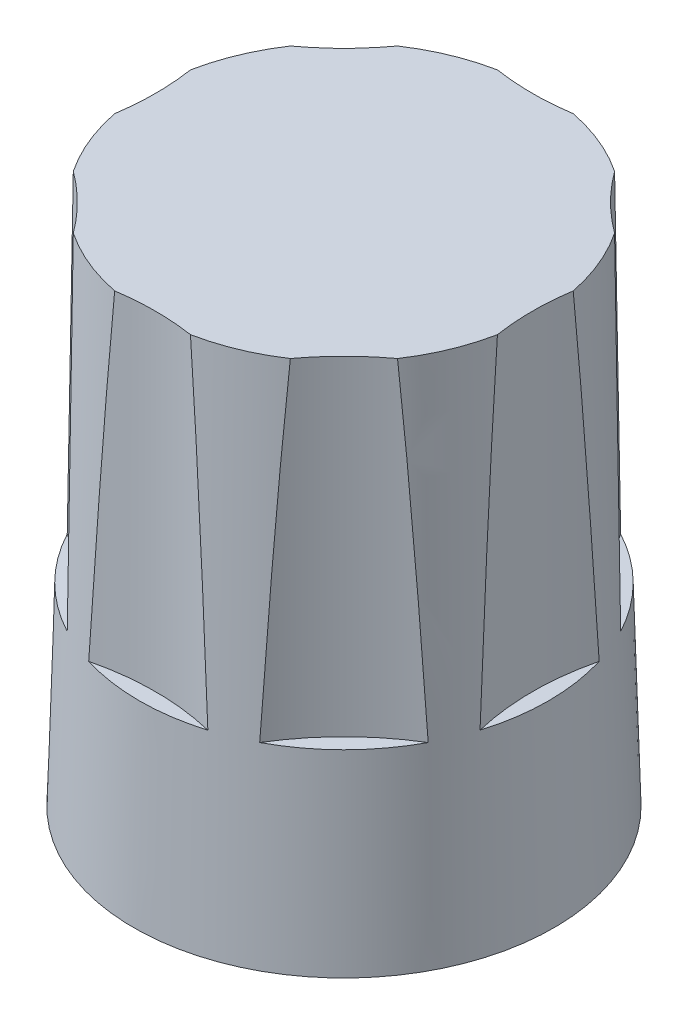
from build123d import *

# Parameters (mm, degrees)
SKETCH2_R           = 7.624300038
CUT_EXTRUDE1_DEPTH  = 10
CIRPATTERN1_COUNT   = 8
SKETCH3_W           = 1.605
SKETCH3_H           = 0.82
SKETCH3_W_2         = 0.82
SKETCH3_H_2         = 1.605
BOSS_EXTRUDE1_DEPTH = 14.88


with BuildPart() as part:
    # Sketch1 → Revolve1 (revolve)
    with BuildSketch(Plane.XY, mode=Mode.PRIVATE) as revolve1_sk:
        Polygon((-6.375, 0), (-5.92, 15.88), (0, 15.88), (0, 14.88), (-4.448652393, 14.88), (-4.875, 0), align=None)
    revolve(revolve1_sk.sketch.rotate(Axis((0, 0, 0), (0, 1, 0)), 270), axis=Axis((0, 0, 0), (0, 1, 0)))

    # Sketch2 → Cut-Extrude1 (cut)
    with BuildSketch(Plane(origin=(0, 15.88, 0), x_dir=(1, 0, 0), z_dir=(0, 1, 0))):
        with Locations((-13.344300038, 0)):
            Circle(SKETCH2_R)
    cut_extrude1 = extrude(amount=-CUT_EXTRUDE1_DEPTH, mode=Mode.SUBTRACT)

    # CirPattern1: Cut-Extrude1 ×8 about axis
    cirpattern1_axis = Axis((0, 0, 0), (0, 1, 0))
    for i in range(1, CIRPATTERN1_COUNT):
        add(cut_extrude1.rotate(cirpattern1_axis, i * 360 / CIRPATTERN1_COUNT), mode=Mode.SUBTRACT)

    # Sketch3 → Boss-Extrude1 (add)
    with BuildSketch(Plane.XZ.offset(-14.88)):
        with Locations((-4.0725, 0)):
            Rectangle(SKETCH3_W, SKETCH3_H)
        Polygon((-4.016873843, 2.792570416), (-2.62690307, 1.990070416), (-3.03690307, 1.279929584), (-4.426873843, 2.082429584), align=None)
        Polygon((-2.082429584, 4.426873843), (-1.279929584, 3.03690307), (-1.990070416, 2.62690307), (-2.792570416, 4.016873843), align=None)
        with Locations((0, 4.0725)):
            Rectangle(SKETCH3_W_2, SKETCH3_H_2)
        Polygon((2.792570416, 4.016873843), (1.990070416, 2.62690307), (1.279929584, 3.03690307), (2.082429584, 4.426873843), align=None)
        Polygon((4.426873843, 2.082429584), (3.03690307, 1.279929584), (2.62690307, 1.990070416), (4.016873843, 2.792570416), align=None)
        with Locations((4.0725, 0)):
            Rectangle(SKETCH3_W, SKETCH3_H)
        Polygon((4.016873843, -2.792570416), (2.62690307, -1.990070416), (3.03690307, -1.279929584), (4.426873843, -2.082429584), align=None)
        Polygon((2.082429584, -4.426873843), (1.279929584, -3.03690307), (1.990070416, -2.62690307), (2.792570416, -4.016873843), align=None)
        with Locations((0, -4.0725)):
            Rectangle(SKETCH3_W_2, SKETCH3_H_2)
        Polygon((-2.792570416, -4.016873843), (-1.990070416, -2.62690307), (-1.279929584, -3.03690307), (-2.082429584, -4.426873843), align=None)
        Polygon((-4.426873843, -2.082429584), (-3.03690307, -1.279929584), (-2.62690307, -1.990070416), (-4.016873843, -2.792570416), align=None)
    extrude(amount=BOSS_EXTRUDE1_DEPTH)


solid = part.part
